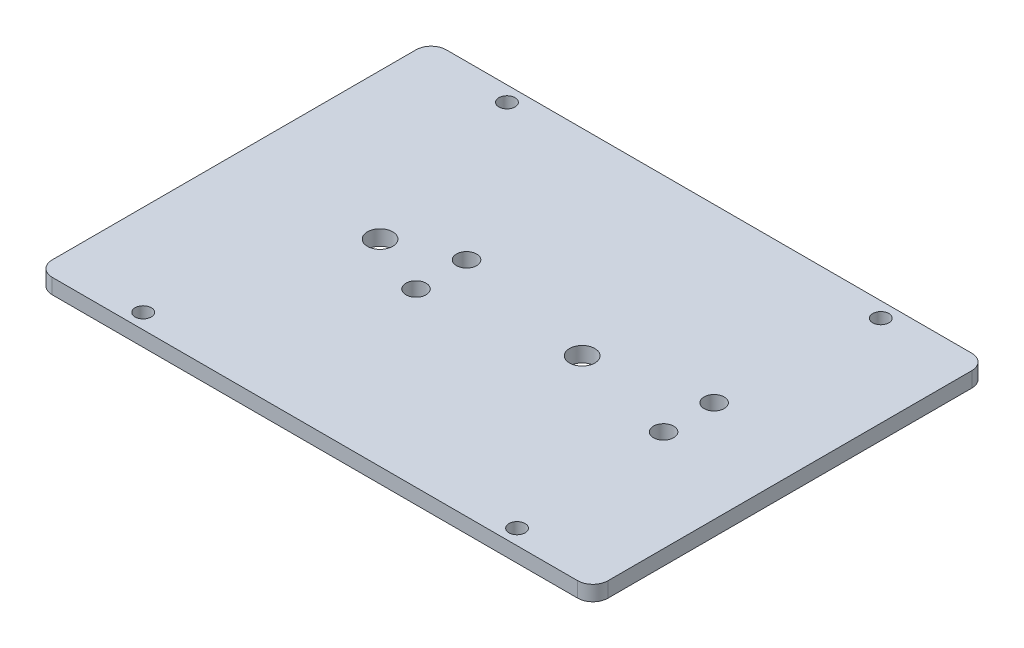
from build123d import *

# Parameters (mm, degrees)
SKETCH_1_W          = 110
SKETCH_1_H          = 78
SKETCH_1_R          = 1.6
EXTRUDE_1_DEPTH     = 3
FILLET_1_R          = 3
SKETCH_2_R          = 2
CUT_EXTRUDE_1_DEPTH = 10
SKETCH_3_R          = 2.5
CUT_EXTRUDE_2_DEPTH = 10


with BuildPart() as part:
    # 草图1 → 凸台-拉伸1 (new body)
    with BuildSketch(Plane(origin=(0, 0, 0), x_dir=(1, 0, 0), z_dir=(0, 1, 0))):
        Rectangle(SKETCH_1_W, SKETCH_1_H)
        with Locations(Location((-37, 36, 0), (0, 0, 270))):
            Circle(SKETCH_1_R, mode=Mode.SUBTRACT)
        with Locations(Location((37, 36, 0), (0, 0, 270))):
            Circle(SKETCH_1_R, mode=Mode.SUBTRACT)
        with Locations(Location((37, -36, 0), (0, 0, 270))):
            Circle(SKETCH_1_R, mode=Mode.SUBTRACT)
        with Locations(Location((-37, -36, 0), (0, 0, 270))):
            Circle(SKETCH_1_R, mode=Mode.SUBTRACT)
    extrude(amount=EXTRUDE_1_DEPTH)

    # 圆角1
    fillet_1_edges = [part.edges().sort_by_distance(p)[0] for p in [
        (-55, 1.5, -39),
        (55, 1.5, -39),
        (55, 1.5, 39),
        (-55, 1.5, 39),
    ]]
    fillet(fillet_1_edges, radius=FILLET_1_R)

    # 草图2 → 切除-拉伸1 (cut)
    with BuildSketch(Plane(origin=(0, 3, 0), x_dir=(1, 0, 0), z_dir=(0, 1, 0))):
        with Locations(Location((-14, 5, 0), (0, 0, 270))):
            Circle(SKETCH_2_R)
        with Locations(Location((35, 5, 0), (0, 0, 270))):
            Circle(SKETCH_2_R)
        with Locations(Location((35, -5, 0), (0, 0, 270))):
            Circle(SKETCH_2_R)
        with Locations(Location((-14, -5, 0), (0, 0, 270))):
            Circle(SKETCH_2_R)
    extrude(amount=-CUT_EXTRUDE_1_DEPTH, mode=Mode.SUBTRACT)

    # 草图3 → 切除-拉伸2 (cut)
    with BuildSketch(Plane.XZ):
        with Locations(Location((-26.110622524, 0, 0), (0, 0, 270))):
            Circle(SKETCH_3_R)
        with Locations(Location((13.889377476, 0, 0), (0, 0, 270))):
            Circle(SKETCH_3_R)
    extrude(amount=-CUT_EXTRUDE_2_DEPTH, mode=Mode.SUBTRACT)


solid = part.part
